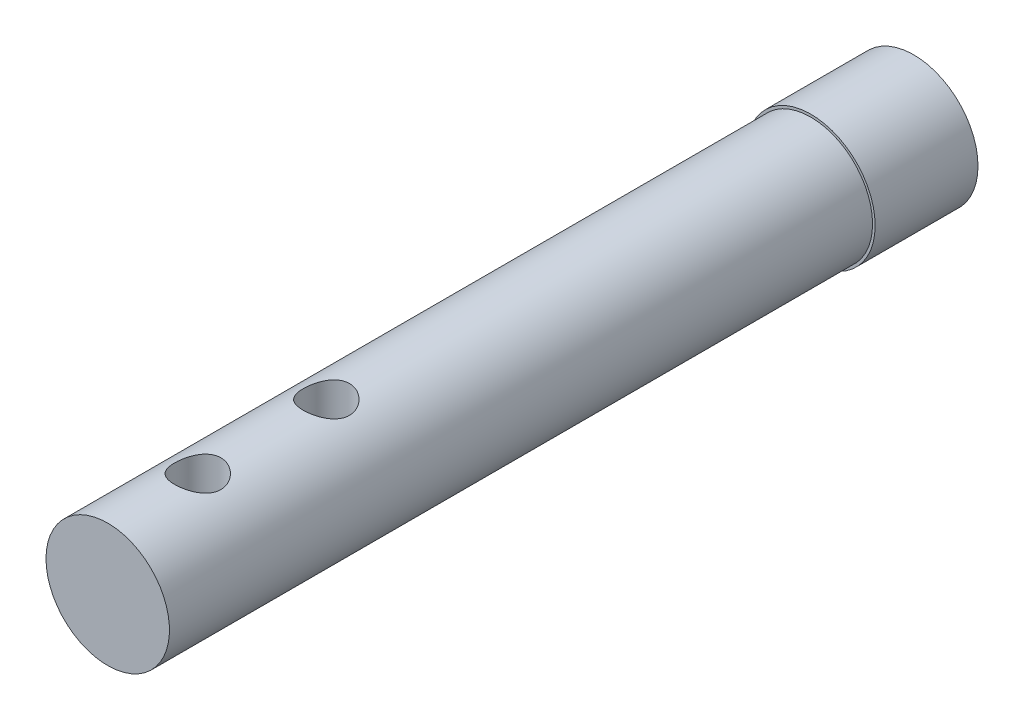
from build123d import *

# Parameters (mm, degrees)
SKETCH1_R               = 10
BOSS_EXTRUDE1_DEPTH     = 15
SKETCH2_R               = 12.5
BOSS_EXTRUDE2_DEPTH     = 20
SKETCH3_R               = 12
BOSS_EXTRUDE3_DEPTH     = 139.2
SKETCH4_R               = 4.5
CUT_EXTRUDE1_DEPTH      = 176.094660113
CUT_EXTRUDE2_DEPTH      = 176.094660212
CUT_EXTRUDE2_DEPTH_BACK = 176.094660212
SKETCH5_W               = 50.129657838
SKETCH5_H               = 19.874218845
LPATTERN1_COUNT         = 2
LPATTERN1_PITCH         = 25
CUT_EXTRUDE3_DEPTH      = 176.094660212
CUT_EXTRUDE3_DEPTH_BACK = 176.094660212
SKETCH6_W               = 27.851197681
SKETCH6_H               = 2.5


with BuildPart() as part:
    # Sketch1 → Boss-Extrude1 (new body)
    with BuildSketch(Plane.XY):
        Circle(SKETCH1_R)
    extrude(amount=BOSS_EXTRUDE1_DEPTH)

    # Sketch2 → Boss-Extrude2 (add)
    with BuildSketch(Plane.XY.offset(15)):
        Circle(SKETCH2_R)
    extrude(amount=BOSS_EXTRUDE2_DEPTH)

    # Sketch3 → Boss-Extrude3 (add)
    with BuildSketch(Plane.XY.offset(35)):
        Circle(SKETCH3_R)
    extrude(amount=BOSS_EXTRUDE3_DEPTH)

    # Sketch4 → Cut-Extrude1 (cut, symmetric)
    with BuildSketch(Plane(origin=(0, 0, 0), x_dir=(1, 0, 0), z_dir=(0, 1, 0))):
        with Locations(Location((0, -154.2, 0), (0, 0, 270))):
            Circle(SKETCH4_R)
    cut_extrude1 = extrude(amount=CUT_EXTRUDE1_DEPTH, both=True, mode=Mode.SUBTRACT)

    # Sketch5 → Cut-Extrude2 (cut, two sides: drawn at the far end of the back side and taken through both)
    with BuildSketch(Plane(origin=(0, 0, 0), x_dir=(1, 0, 0), z_dir=(0, 1, 0)).offset(-CUT_EXTRUDE2_DEPTH_BACK)):
        with Locations((-12.564828919, -5.062890578)):
            Rectangle(SKETCH5_W, SKETCH5_H)
    extrude(amount=CUT_EXTRUDE2_DEPTH + CUT_EXTRUDE2_DEPTH_BACK, mode=Mode.SUBTRACT)

    # LPattern1: Cut-Extrude1 ×2
    with Locations(*[(0, 0, -i * LPATTERN1_PITCH) for i in range(1, LPATTERN1_COUNT)]):
        add(cut_extrude1, mode=Mode.SUBTRACT)

    # Sketch6 → Cut-Extrude3 (cut, two sides: drawn at the far end of the back side and taken through both)
    with BuildSketch(Plane(origin=(0, 0, 0), x_dir=(1, 0, 0), z_dir=(0, 1, 0)).offset(-CUT_EXTRUDE3_DEPTH_BACK)):
        with Locations((-1.925598841, -172.95)):
            Rectangle(SKETCH6_W, SKETCH6_H)
    extrude(amount=CUT_EXTRUDE3_DEPTH + CUT_EXTRUDE3_DEPTH_BACK, mode=Mode.SUBTRACT)


solid = part.part
